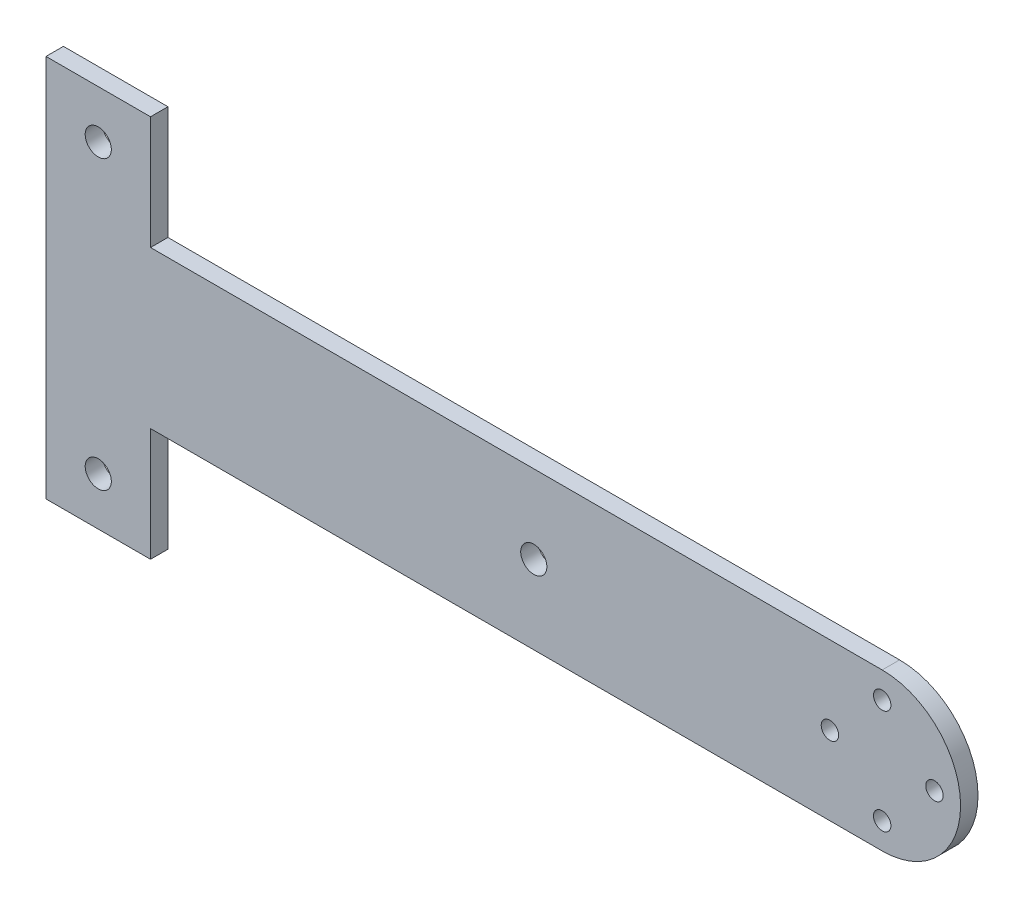
from build123d import *

# Parameters (mm, degrees)
SKETCH_1_R      = 1.5
SKETCH_1_R_2    = 1
EXTRUDE_1_DEPTH = 2


with BuildPart() as part:
    # 草图1 → 凸台-拉伸1 (new body)
    with BuildSketch(Plane.XY):
        with BuildLine():
            Line((41.276428571, -8.854285714), (-42.723571429, -8.854285714))
            Line((-42.723571429, -8.854285714), (-42.723571429, -21.854285714))
            Line((-42.723571429, -21.854285714), (-54.723571429, -21.854285714))
            Line((-54.723571429, -21.854285714), (-54.723571429, 22.145714286))
            Line((-54.723571429, 22.145714286), (-42.723571429, 22.145714286))
            Line((-42.723571429, 22.145714286), (-42.723571429, 9.145714286))
            Line((-42.723571429, 9.145714286), (41.276428571, 9.145714286))
            ThreePointArc((41.276428571, 9.145714286), (50.276428571, 0.145714286), (41.276428571, -8.854285714))
        make_face()
        with Locations((1.276428571, 0.145714286)):
            Circle(SKETCH_1_R, mode=Mode.SUBTRACT)
        with Locations((-48.723571429, 16.645714286)):
            Circle(SKETCH_1_R, mode=Mode.SUBTRACT)
        with Locations((-48.723571429, -16.354285714)):
            Circle(SKETCH_1_R, mode=Mode.SUBTRACT)
        with Locations((41.276428571, 6.145714286)):
            Circle(SKETCH_1_R_2, mode=Mode.SUBTRACT)
        with Locations((47.276428571, 0.145714286)):
            Circle(SKETCH_1_R_2, mode=Mode.SUBTRACT)
        with Locations((41.276428571, -5.854285714)):
            Circle(SKETCH_1_R_2, mode=Mode.SUBTRACT)
        with Locations((35.276428571, 0.145714286)):
            Circle(SKETCH_1_R_2, mode=Mode.SUBTRACT)
    extrude(amount=EXTRUDE_1_DEPTH)


solid = part.part
